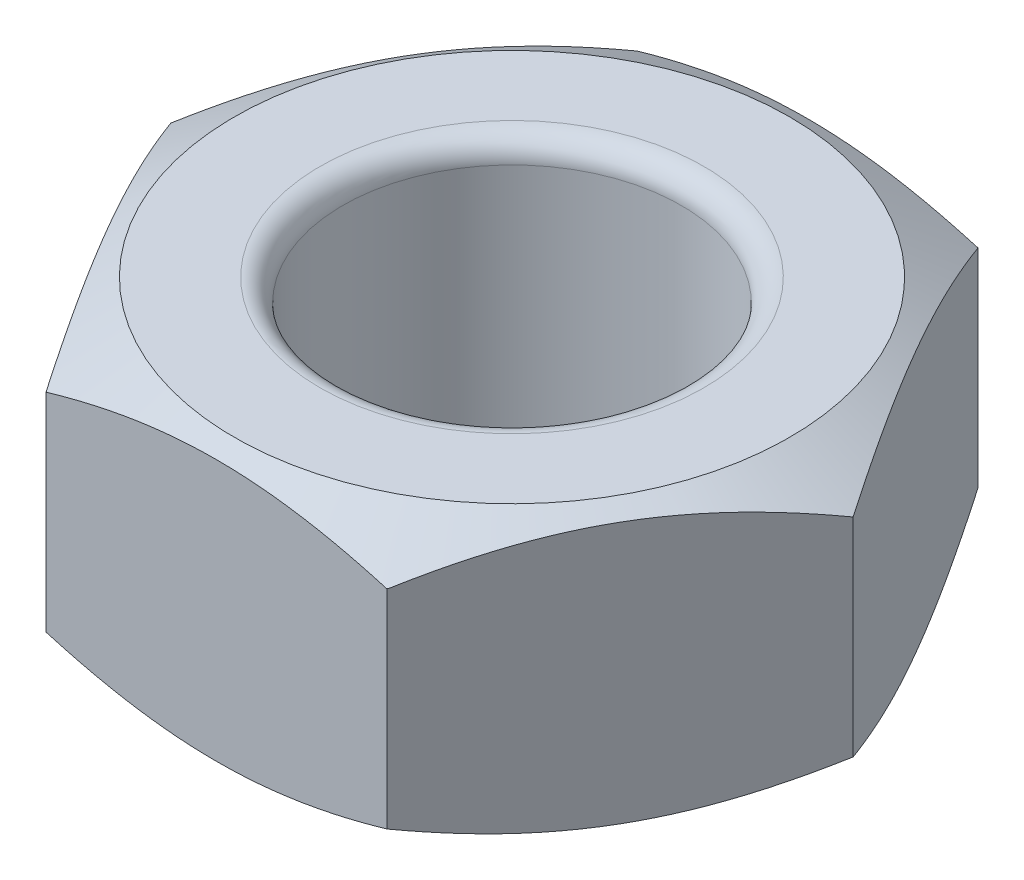
from build123d import *

# Parameters (mm, degrees)
SKETCH1_R           = 3
BOSS_EXTRUDE1_DEPTH = 5
FILLET1_R           = 0.4


with BuildPart() as part:
    # Sketch1 → Boss-Extrude1 (new body)
    with BuildSketch(Plane(origin=(0, 0, 0), x_dir=(1, 0, 0), z_dir=(0, 1, 0))):
        Polygon((6.0450921, 0), (3.02254605, 5.235203327), (-3.02254605, 5.235203327), (-6.0450921, 0), (-3.02254605, -5.235203327), (3.02254605, -5.235203327), align=None)
        with Locations(Location((0, 0, 0), (0, 0, 270))):
            Circle(SKETCH1_R, mode=Mode.SUBTRACT)
    extrude(amount=BOSS_EXTRUDE1_DEPTH)

    # Sketch2 → Cut-Revolve1 (revolve, cut)
    with BuildSketch(Plane(origin=(0, 0, 0), x_dir=(-0.5000000000000041, 0, -0.8660254037844364), z_dir=(0.8660254037844363, 0, -0.500000000000004)), mode=Mode.PRIVATE) as cut_revolve1_sk:
        Polygon((-6.389496142, 4.34485452), (-6.038887138, 4.34485452), (-4.919612053, 5), (-6.274952166, 5.0992455), align=None)
    cut_revolve1 = revolve(cut_revolve1_sk.sketch.rotate(Axis((0, 0, 0), (0, 1, 0)), 150), axis=Axis((0, 0, 0), (0, 1, 0)), mode=Mode.SUBTRACT)

    # Mirror1: Cut-Revolve1 across plane
    add(cut_revolve1.mirror(Plane.ZX.offset(2.5)), mode=Mode.SUBTRACT)

    # Fillet1
    fillet1_edges = [part.edges().sort_by_distance(p)[0] for p in [
        (0, 0, -3),
        (0, 5, -3),
    ]]
    fillet(fillet1_edges, radius=FILLET1_R)


solid = part.part
